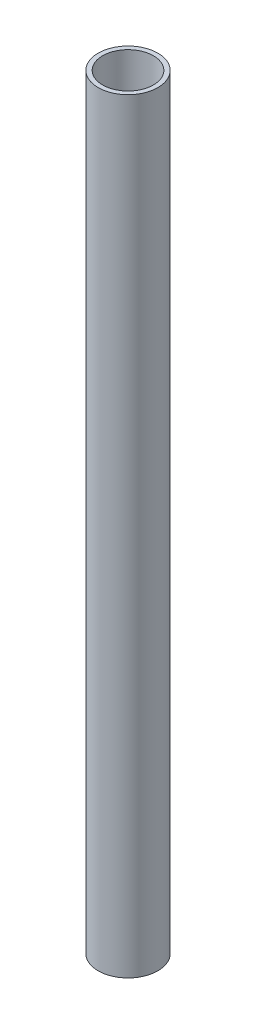
from build123d import *

# Parameters (mm, degrees)
SKETCH_1_R      = 16
SKETCH_1_R_2    = 13.6
EXTRUDE_1_DEPTH = 410


with BuildPart() as part:
    # 草图1 → 凸台-拉伸1 (new body)
    with BuildSketch(Plane(origin=(0, 0, 0), x_dir=(1, 0, 0), z_dir=(0, 1, 0))):
        with Locations(Location((0, 0, 0), (0, 0, 90))):
            Circle(SKETCH_1_R)
        with Locations(Location((0, 0, 0), (0, 0, 90))):
            Circle(SKETCH_1_R_2, mode=Mode.SUBTRACT)
    extrude(amount=EXTRUDE_1_DEPTH)


solid = part.part
